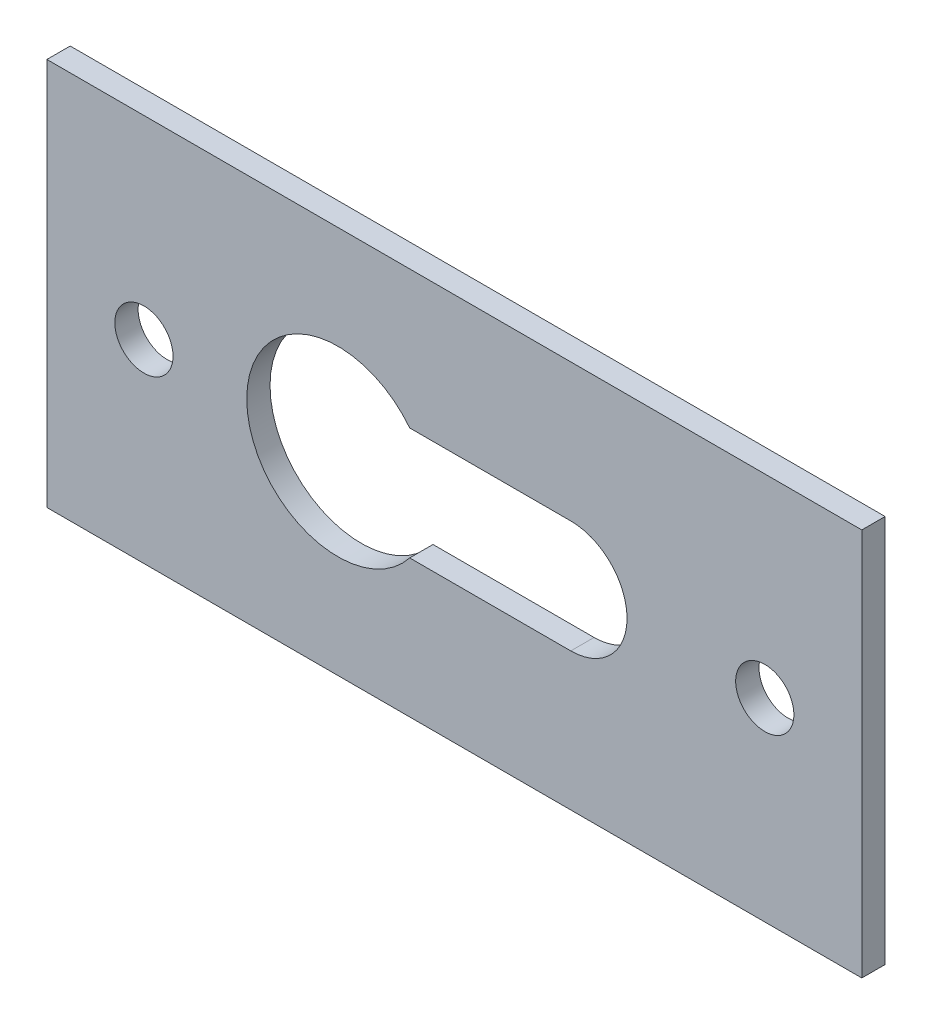
from build123d import *

# Parameters (mm, degrees)
ESQUISSE1_W        = 42
ESQUISSE1_H        = 20
ESQUISSE1_R        = 1.5
BOSS_EXTRU_1_DEPTH = 1.2


with BuildPart() as part:
    # Esquisse1 → Boss.-Extru.1 (new body)
    with BuildSketch(Plane.XY):
        with Locations((21, 0)):
            Rectangle(ESQUISSE1_W, ESQUISSE1_H)
        with Locations((37, 0)):
            Circle(ESQUISSE1_R, mode=Mode.SUBTRACT)
        with Locations((5, 0)):
            Circle(ESQUISSE1_R, mode=Mode.SUBTRACT)
        with BuildLine():
            Line((27, 2.9), (18.698648402, 2.9))
            ThreePointArc((18.698648402, 2.9), (10.3, 0), (18.698648402, -2.9))
            Line((18.698648402, -2.9), (27, -2.9))
            ThreePointArc((27, -2.9), (29.9, 0), (27, 2.9))
        make_face(mode=Mode.SUBTRACT)
    extrude(amount=BOSS_EXTRU_1_DEPTH)


solid = part.part
